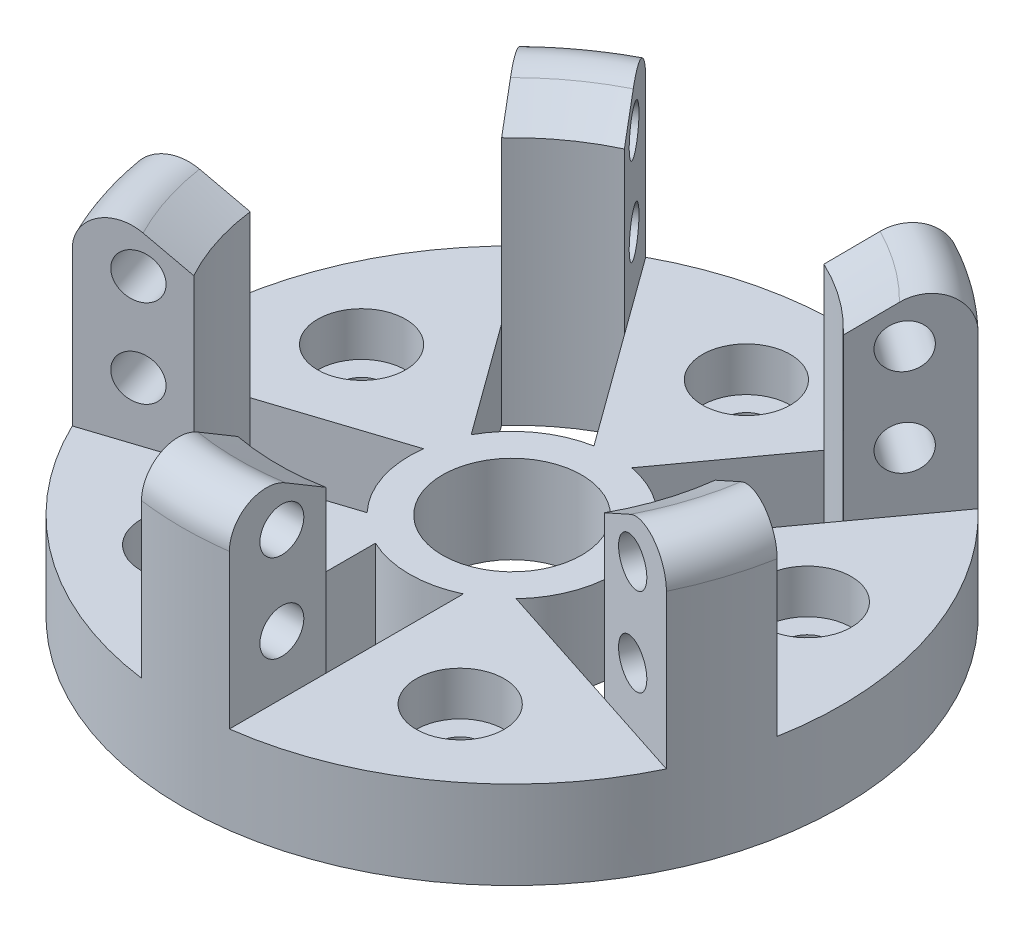
from build123d import *

# Parameters (mm, degrees)
CUT_EXTRUDE_2_DEPTH      = 69.74590907246773
SKETCH_6_R               = 3.000000000000353
SKETCH_6_R_2             = 9.5
SKETCH_6_R_3             = 3.0000000000000013
SKETCH_6_R_4             = 3.0000000000001754
SKETCH_6_R_5             = 3.0000000000002696
SKETCH_6_R_6             = 3.0000000000000875
CUT_EXTRUDE_3_DEPTH      = 69.74590907417861
SKETCH_7_R               = 5.999999999999999
SKETCH_7_R_2             = 3.0000000000000013
SKETCH_7_R_3             = 6.0000000000003535
SKETCH_7_R_4             = 3.000000000000353
SKETCH_7_R_5             = 6.00000000000009
SKETCH_7_R_6             = 3.0000000000000875
SKETCH_7_R_7             = 6.000000000000174
SKETCH_7_R_8             = 3.0000000000001754
SKETCH_7_R_9             = 6.00000000000027
SKETCH_7_R_10            = 3.000000000000269
CUT_EXTRUDE_4_DEPTH      = 6
CUT_EXTRUDE_5_REACH      = 81.273
SKETCH_8_R               = 3.0000000000000018
PATTERN_CIRCULAR_1_COUNT = 5


with BuildPart() as part:
    # 草图2 → 旋转1 (revolve)
    with BuildSketch(Plane(origin=(0, 0, 0), x_dir=(0, 0, -1), z_dir=(1, 0, 0))):
        with BuildLine():
            Line((0, 0), (-45, -6.94e-15))
            Line((-45, -6.94e-15), (-45, 33))
            ThreePointArc((-45, 33), (-42.454374247383356, 37.35615048566752), (-37.40958117848744, 37.27664942789954))
            Line((-37.40958117848744, 37.27664942789954), (-31.99999999999998, 34))
            Line((-31.99999999999998, 34), (-31.999999999999993, 12))
            Line((-31.999999999999993, 12), (3.86e-15, 12))
            Line((3.86e-15, 12), (0, 0))
        make_face()
    revolve(axis=Axis((0, 43.5345852345433, 0), (0, -1, 0)))

    # 草图3 → 切除-拉伸2 (cut, through all)
    with BuildSketch(Plane(origin=(0, 12, 0), x_dir=(1, 0, 0), z_dir=(0, 1, 0))):
        with BuildLine():
            Line((6.000000000000002, -12.649110640673518), (6.000000000000003, -44.59820624195551))
            ThreePointArc((6.000000000000003, -44.59820624195551), (26.450336353161088, -36.40576474687278), (40.561312695237085, -19.48794274517449))
            Line((40.561312695237085, -19.48794274517449), (10.175917133901121, -9.615129249468135))
            ThreePointArc((10.175917133901121, -9.615129249468135), (8.228993532094561, -11.326237921249312), (6.000000000000002, -12.649110640673518))
        make_face()
        with BuildLine():
            Line((-5.999999999999998, -12.649110640673518), (-5.999999999999992, -44.59820624195551))
            ThreePointArc((-5.999999999999992, -44.59820624195551), (-26.45033635316134, -36.405764746872606), (-40.56131269523736, -19.487942745173925))
            Line((-40.56131269523736, -19.487942745173925), (-10.175917133901258, -9.61512924946799))
            ThreePointArc((-10.175917133901258, -9.61512924946799), (-8.228993532094645, -11.326237921249254), (-5.999999999999998, -12.649110640673518))
        make_face()
        with BuildLine():
            Line((-13.884121066400596, 1.7975489460738636), (-44.2695166277367, -8.075264549632074))
            ThreePointArc((-44.2695166277367, -8.075264549632074), (-42.797543233281836, 13.905764746872823), (-31.068269873969072, 32.553995254626194))
            Line((-31.068269873969072, 32.553995254626194), (-12.289062655453339, 6.706633958279081))
            ThreePointArc((-12.289062655453339, 6.706633958279081), (-13.314791228132133, 4.3262379212493185), (-13.884121066400596, 1.7975489460738636))
        make_face()
        with BuildLine():
            Line((-2.5808587229539293, 13.760056985788705), (-21.36006594146967, 39.60741828213582))
            ThreePointArc((-21.36006594146967, 39.60741828213582), (3.225e-13, 44.999999999999986), (21.360065941470232, 39.60741828213551))
            Line((21.360065941470232, 39.60741828213551), (2.5808587229541256, 13.760056985788673))
            ThreePointArc((2.5808587229541256, 13.760056985788673), (1.0033e-13, 14.000000000000002), (-2.5808587229539293, 13.760056985788705))
        make_face()
        with BuildLine():
            Line((12.289062655453431, 6.70663395827891), (31.068269873969538, 32.55399525462576))
            ThreePointArc((31.068269873969538, 32.55399525462576), (42.79754323328205, 13.905764746872206), (44.26951662773658, -8.075264549632692))
            Line((44.26951662773658, -8.075264549632692), (13.88412106640062, 1.797548946073666))
            ThreePointArc((13.88412106640062, 1.797548946073666), (13.314791228132195, 4.32623792124913), (12.289062655453431, 6.70663395827891))
        make_face()
    extrude(amount=CUT_EXTRUDE_2_DEPTH, mode=Mode.SUBTRACT)

    # 草图6 → 切除-拉伸3 (cut, through all)
    with BuildSketch(Plane(origin=(0, 12, 0), x_dir=(1, 0, 0), z_dir=(0, 1, 0))):
        with BuildLine():
            ThreePointArc((12.289062655453431, 6.7066339582789105), (8.228993532094725, 11.326237921249191), (2.580858722954132, 13.760056985788669))
            Line((2.580858722954132, 13.760056985788669), (13.62143875056792, 28.956111727311136))
            ThreePointArc((13.62143875056792, 28.956111727311136), (18.809128073359357, 25.888543819998144), (23.329642683067217, 21.90268869980138))
            Line((23.329642683067217, 21.90268869980138), (12.289062655453431, 6.7066339582789105))
        make_face()
        with BuildLine():
            ThreePointArc((10.175917133901127, -9.615129249468133), (13.314791228132105, -4.326237921249419), (13.88412106640062, 1.7975489460736591))
            Line((13.88412106640062, 1.7975489460736591), (31.7481548065927, -4.006827470284166))
            ThreePointArc((31.7481548065927, -4.006827470284166), (30.433808521444792, -9.888543819998658), (28.039950874093208, -15.419505665825957))
            Line((28.039950874093208, -15.419505665825957), (10.175917133901127, -9.615129249468133))
        make_face()
        with BuildLine():
            ThreePointArc((-5.999999999999995, -12.649110640673522), (8.6e-16, -14.000000000000002), (5.999999999999995, -12.649110640673522))
            Line((5.999999999999995, -12.649110640673522), (5.999999999999995, -31.43246729100341))
            ThreePointArc((5.999999999999995, -31.43246729100341), (1.96e-15, -31.999999999999986), (-5.999999999999995, -31.43246729100341))
            Line((-5.999999999999995, -31.43246729100341), (-5.999999999999995, -12.649110640673522))
        make_face()
        with BuildLine():
            ThreePointArc((-13.884121066400597, 1.7975489460738576), (-13.314791228132165, -4.326237921249228), (-10.175917133901264, -9.615129249467987))
            Line((-10.175917133901264, -9.615129249467987), (-28.03995087409343, -15.419505665825561))
            ThreePointArc((-28.03995087409343, -15.419505665825561), (-30.43380852144493, -9.888543819998239), (-31.748154806592765, -4.006827470283715))
            Line((-31.748154806592765, -4.006827470283715), (-13.884121066400597, 1.7975489460738576))
        make_face()
        with BuildLine():
            ThreePointArc((-2.5808587229539373, 13.760056985788708), (-8.228993532094563, 11.326237921249309), (-12.289062655453337, 6.706633958279092))
            Line((-12.289062655453337, 6.706633958279092), (-23.32964268306691, 21.902688699801722))
            ThreePointArc((-23.32964268306691, 21.902688699801722), (-18.80912807335899, 25.888543819998407), (-13.621438750567506, 28.956111727311335))
            Line((-13.621438750567506, 28.956111727311335), (-2.5808587229539373, 13.760056985788708))
        make_face()
        with Locations(Location((-30.433808521444917, 9.888543819998311, 0), (0, 0, 270))):
            Circle(SKETCH_6_R)
        with Locations(Location((0, 0, 0), (0, 0, 270))):
            Circle(SKETCH_6_R_2)
        with Locations(Location((0, 32, 0), (0, 0, 270))):
            Circle(SKETCH_6_R_3)
        with Locations(Location((18.809128073359144, -25.888543819998315, 0), (0, 0, 270))):
            Circle(SKETCH_6_R_4)
        with Locations(Location((-18.80912807335914, -25.888543819998322, 0), (0, 0, 270))):
            Circle(SKETCH_6_R_5)
        with Locations(Location((30.433808521444917, 9.888543819998324, 0), (0, 0, 270))):
            Circle(SKETCH_6_R_6)
    extrude(amount=-CUT_EXTRUDE_3_DEPTH, mode=Mode.SUBTRACT)

    # 草图7 → 切除-拉伸4 (cut)
    # profile 1 of 5: a face of its own
    with BuildSketch(Plane(origin=(0, 12, 0), x_dir=(1, 0, 0), z_dir=(0, 1, 0))):
        with Locations(Location((0, 32, 0), (0, 0, 270))):
            Circle(SKETCH_7_R)
        with Locations(Location((0, 32, 0), (0, 0, 270))):
            Circle(SKETCH_7_R_2, mode=Mode.SUBTRACT)
    # profile 2 of 5: a face of its own
    with BuildSketch(Plane(origin=(0, 12, 0), x_dir=(1, 0, 0), z_dir=(0, 1, 0))):
        with Locations(Location((-30.433808521444917, 9.888543819998311, 0), (0, 0, 270))):
            Circle(SKETCH_7_R_3)
        with Locations(Location((-30.433808521444917, 9.888543819998311, 0), (0, 0, 270))):
            Circle(SKETCH_7_R_4, mode=Mode.SUBTRACT)
    # profile 3 of 5: a face of its own
    with BuildSketch(Plane(origin=(0, 12, 0), x_dir=(1, 0, 0), z_dir=(0, 1, 0))):
        with Locations(Location((30.433808521444917, 9.888543819998324, 0), (0, 0, 270))):
            Circle(SKETCH_7_R_5)
        with Locations(Location((30.433808521444917, 9.888543819998324, 0), (0, 0, 270))):
            Circle(SKETCH_7_R_6, mode=Mode.SUBTRACT)
    # profile 4 of 5: a face of its own
    with BuildSketch(Plane(origin=(0, 12, 0), x_dir=(1, 0, 0), z_dir=(0, 1, 0))):
        with Locations(Location((18.809128073359144, -25.888543819998315, 0), (0, 0, 270))):
            Circle(SKETCH_7_R_7)
        with Locations(Location((18.809128073359144, -25.888543819998315, 0), (0, 0, 270))):
            Circle(SKETCH_7_R_8, mode=Mode.SUBTRACT)
    # profile 5 of 5: a face of its own
    with BuildSketch(Plane(origin=(0, 12, 0), x_dir=(1, 0, 0), z_dir=(0, 1, 0))):
        with Locations(Location((-18.80912807335914, -25.888543819998322, 0), (0, 0, 270))):
            Circle(SKETCH_7_R_9)
        with Locations(Location((-18.80912807335914, -25.888543819998322, 0), (0, 0, 270))):
            Circle(SKETCH_7_R_10, mode=Mode.SUBTRACT)
    extrude(amount=-CUT_EXTRUDE_4_DEPTH, mode=Mode.SUBTRACT)

    # 草图8 → 切除-拉伸5 (cut, up to next)
    with BuildSketch(Plane(origin=(-4.854101966249707, 0, 3.5267115137548144), x_dir=(0.5877852522924687, 0, 0.8090169943749507), z_dir=(-0.8090169943749507, 0, 0.5877852522924687)), mode=Mode.PRIVATE) as cut_extrude_5_sk1:
        with Locations((-37.4324672910034, 32)):
            Circle(SKETCH_8_R)
    cut_extrude_5_tool1 = extrude(cut_extrude_5_sk1.sketch, amount=-CUT_EXTRUDE_5_REACH, mode=Mode.PRIVATE) & part.part
    # 草图8 → 切除-拉伸5 (cut, up to next)
    with BuildSketch(Plane(origin=(-4.854101966249707, 0, 3.5267115137548144), x_dir=(0.5877852522924687, 0, 0.8090169943749507), z_dir=(-0.8090169943749507, 0, 0.5877852522924687)), mode=Mode.PRIVATE) as cut_extrude_5_sk2:
        with Locations((-37.4324672910034, 19.999999999999993)):
            Circle(SKETCH_8_R)
    cut_extrude_5_tool2 = extrude(cut_extrude_5_sk2.sketch, amount=-CUT_EXTRUDE_5_REACH, mode=Mode.PRIVATE) & part.part
    cut_extrude_5_1 = cut_extrude_5_tool1.solids().sort_by_distance((-26.856354, 32, -26.756791))[0]
    add(cut_extrude_5_1, mode=Mode.SUBTRACT)
    cut_extrude_5_2 = cut_extrude_5_tool2.solids().sort_by_distance((-26.856354, 20, -26.756791))[0]
    add(cut_extrude_5_2, mode=Mode.SUBTRACT)
    cut_extrude_5 = cut_extrude_5_1 + cut_extrude_5_2  # 切除-拉伸5 as one shape, for the pattern or mirror that repeats it

    # 阵列(圆周)1: 切除-拉伸5 ×5 about axis
    pattern_circular_1_axis = Axis((0, 12, 0), (0, 1, 0))
    for i in range(1, PATTERN_CIRCULAR_1_COUNT):
        add(cut_extrude_5.rotate(pattern_circular_1_axis, i * 360 / PATTERN_CIRCULAR_1_COUNT), mode=Mode.SUBTRACT)


solid = part.part
